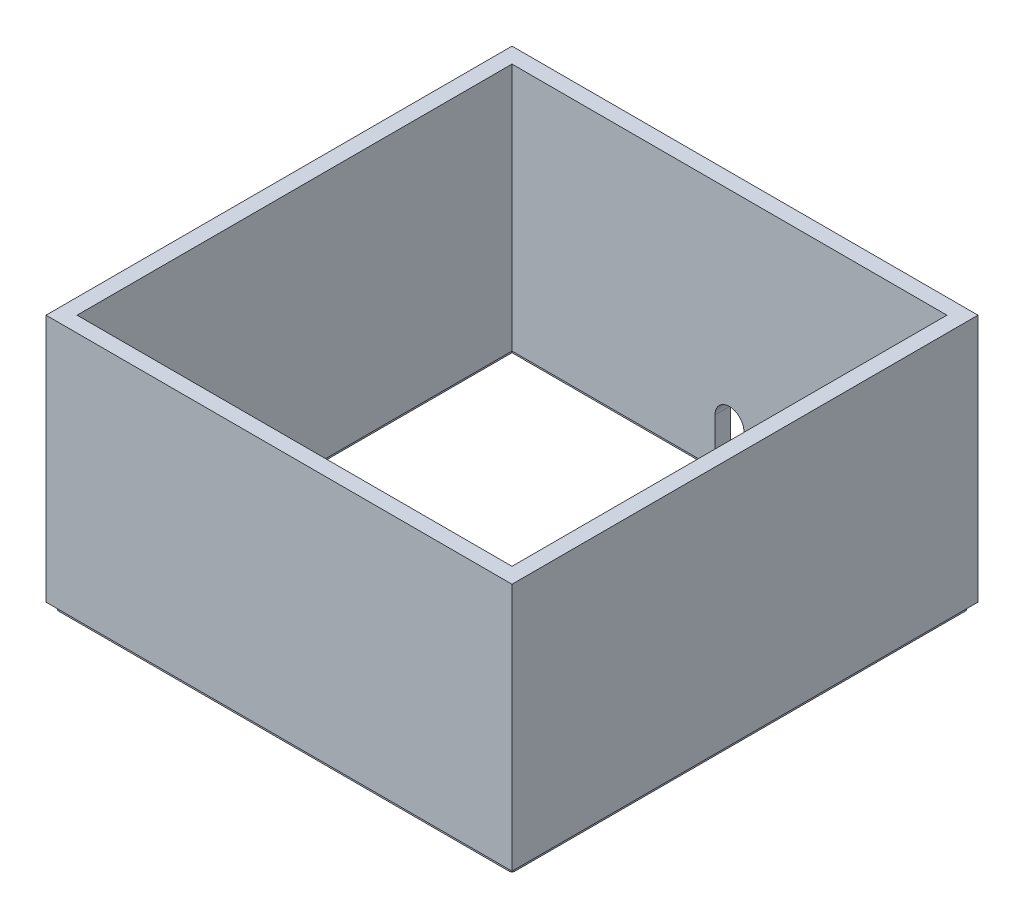
from build123d import *

# Parameters (mm, degrees)
SKETCH1_W           = 150
SKETCH1_H           = 150
SKETCH1_W_2         = 140
SKETCH1_H_2         = 140
BOSS_EXTRUDE1_DEPTH = 80
BOSS_EXTRUDE2_DEPTH = 2
CIRPATTERN1_COUNT   = 4
CUT_EXTRUDE1_DEPTH  = 10


with BuildPart() as part:
    # Sketch1 → Boss-Extrude1 (new body)
    with BuildSketch(Plane(origin=(0, 91.979453816, 0), x_dir=(1, 0, 0), z_dir=(0, 1, 0))):
        with Locations((62.661143414, -111.558685069)):
            Rectangle(SKETCH1_W, SKETCH1_H)
        with Locations((62.661143414, -111.558685069)):
            Rectangle(SKETCH1_W_2, SKETCH1_H_2, mode=Mode.SUBTRACT)
    extrude(amount=BOSS_EXTRUDE1_DEPTH)

    # Sketch5 → Boss-Extrude2 (add)
    with BuildSketch(Plane.XZ.offset(-91.979453816)):
        with BuildLine():
            Line((-8.863856586, 184.058685069), (-8.863856586, 39.058685069))
            ThreePointArc((-8.863856586, 39.058685069), (-9.838856586, 38.083685069), (-10.813856586, 39.058685069))
            Line((-10.813856586, 39.058685069), (-10.813856586, 184.058685069))
            ThreePointArc((-10.813856586, 184.058685069), (-9.838856586, 185.033685069), (-8.863856586, 184.058685069))
        make_face()
    boss_extrude2 = extrude(amount=BOSS_EXTRUDE2_DEPTH)

    # CirPattern1: Boss-Extrude2 ×4 about axis
    cirpattern1_axis = Axis((62.661143414, 0, 111.558685069), (0, 1, 0))
    for i in range(1, CIRPATTERN1_COUNT):
        add(boss_extrude2.rotate(cirpattern1_axis, i * 360 / CIRPATTERN1_COUNT))

    # Sketch6 → Cut-Extrude1 (cut)
    with BuildSketch(Plane(origin=(0, 0, 36.558685069), x_dir=(-1, 0, 0), z_dir=(0, 0, -1))):
        with BuildLine():
            Line((-67.328548343, 91.979453816), (-67.328548343, 106.844407314))
            ThreePointArc((-67.328548343, 106.844407314), (-62.661143414, 111.511812242), (-57.993738486, 106.844407314))
            Line((-57.993738486, 106.844407314), (-57.993738486, 91.979453816))
            Line((-57.993738486, 91.979453816), (-57.993738486, 79.02025395))
            Line((-57.993738486, 79.02025395), (-67.328548343, 79.02025395))
            Line((-67.328548343, 79.02025395), (-67.328548343, 91.979453816))
        make_face()
    extrude(amount=-CUT_EXTRUDE1_DEPTH, mode=Mode.SUBTRACT)


solid = part.part
